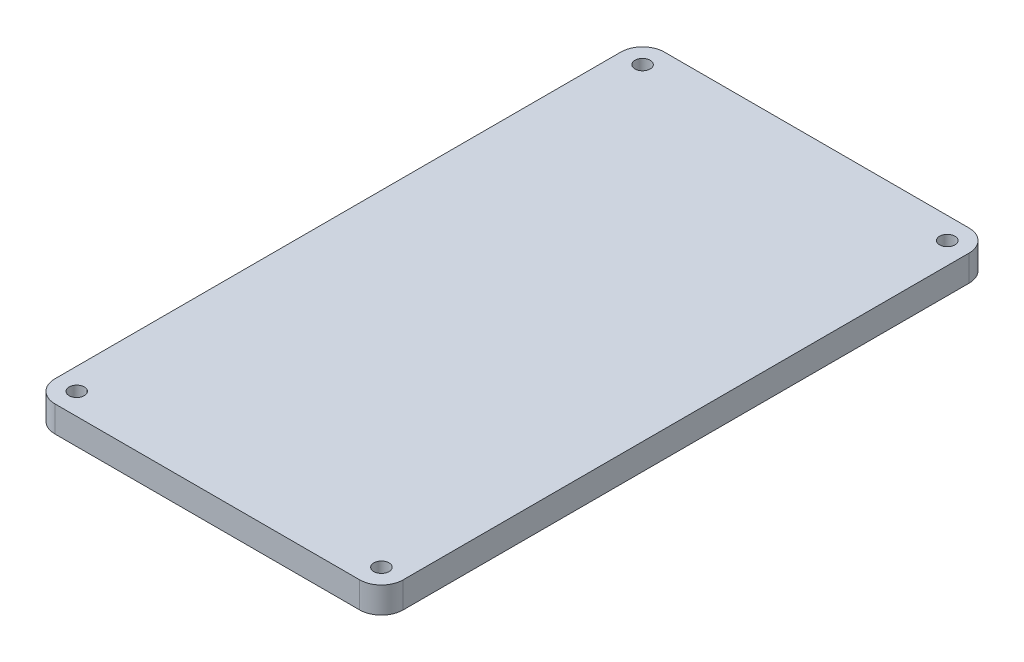
from build123d import *

# Parameters (mm, degrees)
SKETCH1_W           = 80
SKETCH1_H           = 140
BOSS_EXTRUDE1_DEPTH = 6
SKETCH2_R           = 1.75
CUT_EXTRUDE1_DEPTH  = 81.845531726
FILLET1_R           = 5


with BuildPart() as part:
    # Sketch1 → Boss-Extrude1 (new body)
    with BuildSketch(Plane(origin=(0, 0, 0), x_dir=(1, 0, 0), z_dir=(0, 1, 0))):
        Rectangle(SKETCH1_W, SKETCH1_H)
    extrude(amount=BOSS_EXTRUDE1_DEPTH)

    # Sketch2 → Cut-Extrude1 (cut, through all)
    with BuildSketch(Plane(origin=(0, 6, 0), x_dir=(1, 0, 0), z_dir=(0, 1, 0))):
        with Locations(Location((-35, 65, 0), (0, 0, 270))):
            Circle(SKETCH2_R)
        with Locations(Location((35, 65, 0), (0, 0, 270))):
            Circle(SKETCH2_R)
        with Locations(Location((-35, -65, 0), (0, 0, 270))):
            Circle(SKETCH2_R)
        with Locations(Location((35, -65, 0), (0, 0, 270))):
            Circle(SKETCH2_R)
    extrude(amount=-CUT_EXTRUDE1_DEPTH, mode=Mode.SUBTRACT)

    # Fillet1
    fillet1_edges = [part.edges().sort_by_distance(p)[0] for p in [
        (40, 3, 70),
        (-40, 3, 70),
        (-40, 3, -70),
        (40, 3, -70),
    ]]
    fillet(fillet1_edges, radius=FILLET1_R)


solid = part.part
